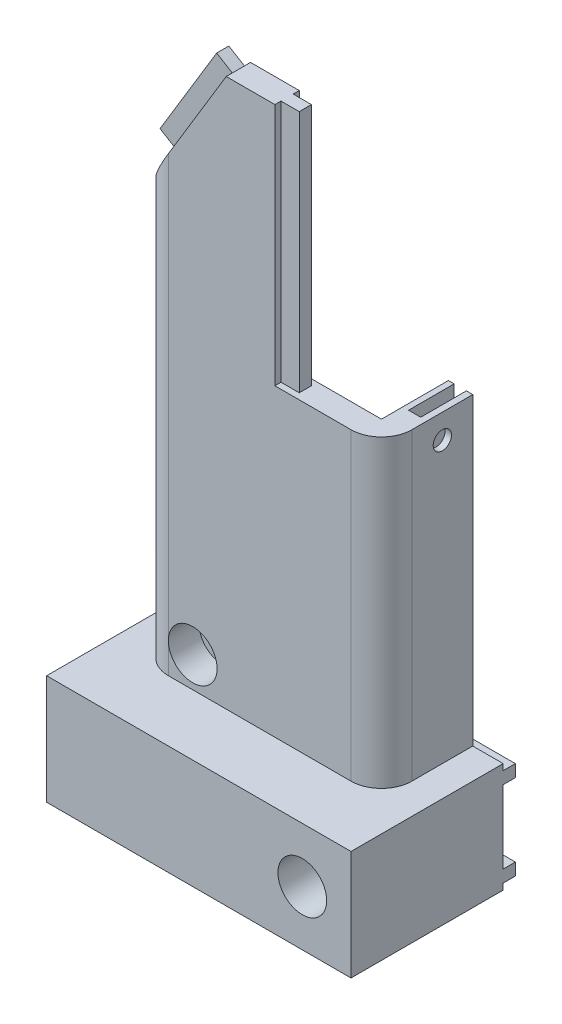
from build123d import *

# Parameters (mm, degrees)
SKETCH1_W                = 40
SKETCH1_H                = 30
BOSS_EXTRUDE1_DEPTH      = 90
SHELL1_T                 = -4
FILLET1_R                = 5
CUT_EXTRUDE1_DEPTH       = 94.407708461
CUT_EXTRUDE1_DEPTH_BACK  = 94.407708461
CUT_EXTRUDE2_DEPTH       = 94.407708461
CUT_EXTRUDE2_DEPTH_BACK  = 94.407708461
SKETCH3_W                = 17.5
SKETCH3_H                = 40
SKETCH5_W                = 2
SKETCH5_H                = 40
BOSS_EXTRUDE2_DEPTH      = 3
SKETCH6_W                = 2
SKETCH6_H                = 18
BOSS_EXTRUDE3_DEPTH      = 3
SKETCH8_W                = 50
SKETCH8_H                = 50
BOSS_EXTRUDE4_DEPTH      = 18
SKETCH10_W               = 45
SKETCH10_H               = 10
CUT_EXTRUDE4_DEPTH       = 37.5
BOSS_EXTRUDE5_REACH      = 103.502
SKETCH15_W               = 10
SKETCH15_H               = 10
CUT_EXTRUDE8_DEPTH       = 103.988587343
CUT_EXTRUDE8_DEPTH_BACK  = 103.988587343
SKETCH20_R               = 2
SKETCH21_R               = 4
CUT_EXTRUDE9_DEPTH       = 5
SKETCH23_W               = 2
SKETCH23_H               = 15
CUT_EXTRUDE10_DEPTH      = 10
CUT_EXTRUDE11_START      = -10
SKETCH24_R               = 1.5
CUT_EXTRUDE11_DEPTH      = 116.031657717
CUT_EXTRUDE12_DEPTH      = 99.140965569
CUT_EXTRUDE12_DEPTH_BACK = 99.140965569
SKETCH27_W               = 50
SKETCH27_H               = 25
SKETCH29_W               = 50
SKETCH29_H               = 2
BOSS_EXTRUDE6_DEPTH      = 2
SKETCH30_W               = 50
SKETCH30_H               = 2
BOSS_EXTRUDE7_DEPTH      = 2
CUT_EXTRUDE13_DEPTH      = 99.66939304
CUT_EXTRUDE13_DEPTH_BACK = 99.66939304
SKETCH31_R               = 2
SKETCH32_R               = 4
CUT_EXTRUDE14_DEPTH      = 15


with BuildPart() as part:
    # Sketch1 → Boss-Extrude1 (new body)
    with BuildSketch(Plane(origin=(0, 0, 0), x_dir=(1, 0, 0), z_dir=(0, 1, 0))):
        Rectangle(SKETCH1_W, SKETCH1_H)
    extrude(amount=BOSS_EXTRUDE1_DEPTH)

    # Shell1
    shell1_openings = [part.faces().sort_by_distance(p)[0] for p in [
        (0, 90, 0),
        (0, 0, 0),
    ]]
    offset(amount=SHELL1_T, openings=shell1_openings, kind=Kind.INTERSECTION)

    # Fillet1
    fillet1_edges = [part.edges().sort_by_distance(p)[0] for p in [
        (20, 45, 15),
        (-20, 45, 15),
        (-20, 45, -15),
        (20, 45, -15),
    ]]
    fillet(fillet1_edges, radius=FILLET1_R)

    # Sketch2 → Cut-Extrude1 (cut, two sides: drawn at the far end of the back side and taken through both)
    with BuildSketch(Plane.XY.offset(-CUT_EXTRUDE1_DEPTH_BACK)):
        Polygon((-5.5, 90), (-20, 66), (-20, 90), align=None)
    extrude(amount=CUT_EXTRUDE1_DEPTH + CUT_EXTRUDE1_DEPTH_BACK, mode=Mode.SUBTRACT)

    # Sketch3 → Cut-Extrude2 (cut, two sides: drawn at the far end of the back side and taken through both)
    with BuildSketch(Plane.XY.offset(-CUT_EXTRUDE2_DEPTH_BACK)):
        with Locations((11.25, 70)):
            Rectangle(SKETCH3_W, SKETCH3_H)
    extrude(amount=CUT_EXTRUDE2_DEPTH + CUT_EXTRUDE2_DEPTH_BACK, mode=Mode.SUBTRACT)

    # Sketch5 → Boss-Extrude2 (add)
    with BuildSketch(Plane(origin=(2.5, 0, 0), x_dir=(0, 0, -1), z_dir=(1, 0, 0))):
        with Locations((-13, 70)):
            Rectangle(SKETCH5_W, SKETCH5_H)
    boss_extrude2 = extrude(amount=BOSS_EXTRUDE2_DEPTH)

    # Mirror1: Boss-Extrude2 across plane
    add(boss_extrude2.mirror(Plane.XY))

    # Sketch6 → Boss-Extrude3 (add)
    with BuildSketch(Plane(origin=(-43.86391097, 26.501112878, 0), x_dir=(0, 0, 1), z_dir=(-0.8559155419457906, 0.5171156399255814, 0))):
        with Locations((-13, 65.188262756)):
            Rectangle(SKETCH6_W, SKETCH6_H)
    boss_extrude3 = extrude(amount=BOSS_EXTRUDE3_DEPTH)

    # Mirror2: Boss-Extrude3 across plane
    add(boss_extrude3.mirror(Plane.XY))

    # Sketch8 → Boss-Extrude4 (add)
    with BuildSketch(Plane(origin=(0, 0, 0), x_dir=(1, 0, 0), z_dir=(0, 1, 0))):
        Rectangle(SKETCH8_W, SKETCH8_H)
    extrude(amount=-BOSS_EXTRUDE4_DEPTH)

    # Sketch10 → Cut-Extrude4 (cut)
    with BuildSketch(Plane.ZY.offset(25)):
        with Locations((0, -9)):
            Rectangle(SKETCH10_W, SKETCH10_H)
    extrude(amount=-CUT_EXTRUDE4_DEPTH, mode=Mode.SUBTRACT)

    # Sketch15 → Boss-Extrude5 (add, up to next)
    with BuildSketch(Plane.XY.offset(-11), mode=Mode.PRIVATE) as boss_extrude5_sk1:
        with Locations((-11, 5)):
            Rectangle(SKETCH15_W, SKETCH15_H)
    boss_extrude5_tool1 = extrude(boss_extrude5_sk1.sketch, amount=BOSS_EXTRUDE5_REACH, mode=Mode.PRIVATE) - part.part
    add(boss_extrude5_tool1.solids().sort_by_distance((-11, 5, -11))[0])

    # Sketch20 → Cut-Extrude8 (cut, two sides: drawn at the far end of the back side and taken through both)
    with BuildSketch(Plane(origin=(0, 0, -15), x_dir=(-1, 0, 0), z_dir=(0, 0, -1)).offset(-CUT_EXTRUDE8_DEPTH_BACK)):
        with Locations((11, 5)):
            Circle(SKETCH20_R)
    extrude(amount=CUT_EXTRUDE8_DEPTH + CUT_EXTRUDE8_DEPTH_BACK, mode=Mode.SUBTRACT)

    # Sketch21 → Cut-Extrude9 (cut)
    with BuildSketch(Plane(origin=(0, 0, -15), x_dir=(-1, 0, 0), z_dir=(0, 0, -1))):
        with Locations((11, 5)):
            Circle(SKETCH21_R)
    cut_extrude9 = extrude(amount=-CUT_EXTRUDE9_DEPTH, mode=Mode.SUBTRACT)

    # Mirror3: Cut-Extrude9 across plane
    add(cut_extrude9.mirror(Plane.XY), mode=Mode.SUBTRACT)

    # Sketch23 → Cut-Extrude10 (cut)
    with BuildSketch(Plane(origin=(0, 50, 0), x_dir=(1, 0, 0), z_dir=(0, 1, 0))):
        with Locations((17.949489743, 0)):
            Rectangle(SKETCH23_W, SKETCH23_H)
    extrude(amount=-CUT_EXTRUDE10_DEPTH, mode=Mode.SUBTRACT)

    # Sketch24 → Cut-Extrude11 (cut)
    with BuildSketch(Plane(origin=(20, 0, 0), x_dir=(0, 0, -1), z_dir=(1, 0, 0)).offset(CUT_EXTRUDE11_START)):
        with Locations(Location((-5, 46, 0), (0, 0, 180))):
            Circle(SKETCH24_R)
    cut_extrude11 = extrude(amount=CUT_EXTRUDE11_DEPTH, mode=Mode.SUBTRACT)

    # Mirror4: Cut-Extrude11 across plane
    add(cut_extrude11.mirror(Plane.XY), mode=Mode.SUBTRACT)

    # Sketch27 → Cut-Extrude12 (cut, two sides: drawn at the far end of the back side and taken through both)
    with BuildSketch(Plane(origin=(0, 0, 0), x_dir=(1, 0, 0), z_dir=(0, 1, 0)).offset(-CUT_EXTRUDE12_DEPTH_BACK)):
        with Locations((0, 12.5)):
            Rectangle(SKETCH27_W, SKETCH27_H)
    extrude(amount=CUT_EXTRUDE12_DEPTH + CUT_EXTRUDE12_DEPTH_BACK, mode=Mode.SUBTRACT)

    # Sketch29 → Boss-Extrude6 (add)
    with BuildSketch(Plane(origin=(0, 0, 0), x_dir=(-1, 0, 0), z_dir=(0, 0, -1))):
        with Locations((0, -2)):
            Rectangle(SKETCH29_W, SKETCH29_H)
    extrude(amount=BOSS_EXTRUDE6_DEPTH)

    # Sketch30 → Boss-Extrude7 (add)
    with BuildSketch(Plane(origin=(0, 0, 0), x_dir=(-1, 0, 0), z_dir=(0, 0, -1))):
        with Locations((0, -16)):
            Rectangle(SKETCH30_W, SKETCH30_H)
    extrude(amount=BOSS_EXTRUDE7_DEPTH)

    # Sketch31 → Cut-Extrude13 (cut, two sides: drawn at the far end of the back side and taken through both)
    with BuildSketch(Plane.XY.offset(25).offset(-CUT_EXTRUDE13_DEPTH_BACK)):
        with Locations((17, -9)):
            Circle(SKETCH31_R)
    extrude(amount=CUT_EXTRUDE13_DEPTH + CUT_EXTRUDE13_DEPTH_BACK, mode=Mode.SUBTRACT)

    # Sketch32 → Cut-Extrude14 (cut)
    with BuildSketch(Plane.XY.offset(25)):
        with Locations((17, -9)):
            Circle(SKETCH32_R)
    extrude(amount=-CUT_EXTRUDE14_DEPTH, mode=Mode.SUBTRACT)


solid = part.part
